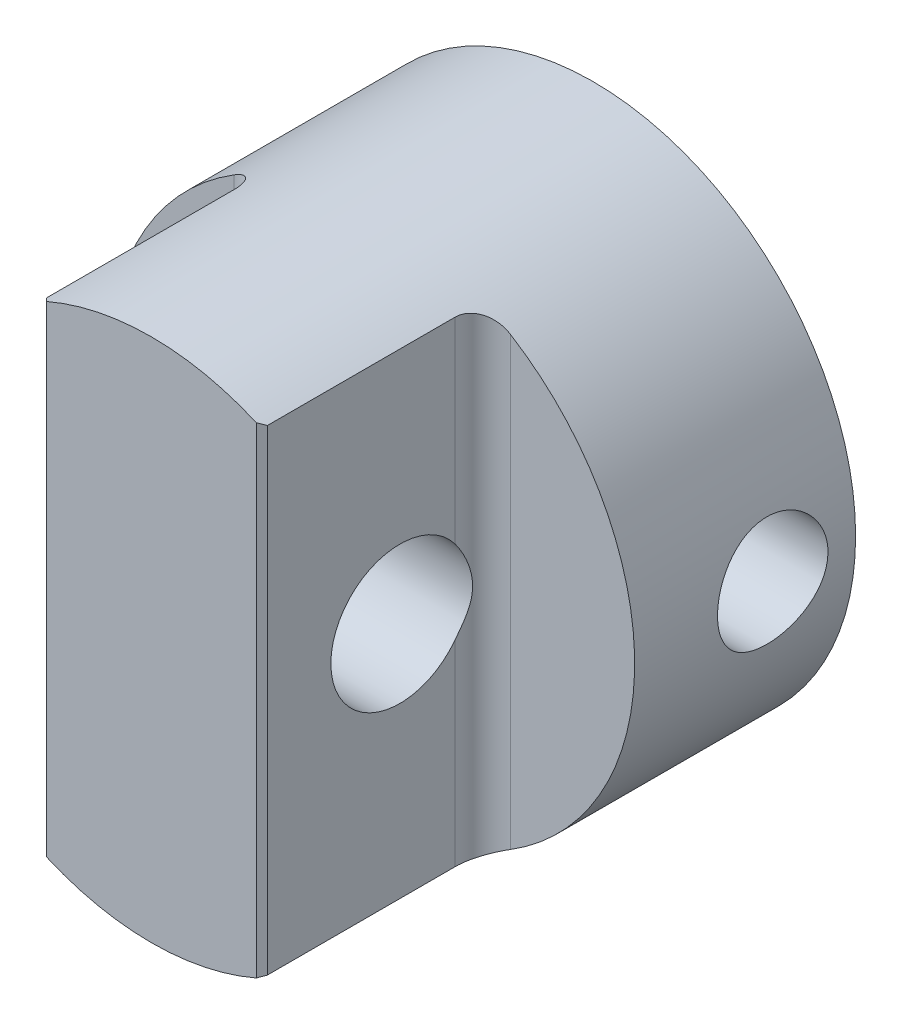
from build123d import *

# Parameters (mm, degrees)
SKETCH_1_R               = 47.5
EXTRUDE_1_DEPTH          = 80
CUT_EXTRUDE_START        = -40
CUT_EXTRUDE_1_DEPTH      = 40
FILLET_1_R               = 5
SKETCH_3_R               = 12.5
CUT_EXTRUDE_2_DEPTH      = 115.945639495
CHAMFER_1_SIZE           = 1
CUT_EXTRUDE_3_DEPTH      = 105.462912246
CUT_EXTRUDE_3_DEPTH_BACK = 105.462912246
SKETCH_4_R               = 10


with BuildPart() as part:
    # Эскиз1 → Бобышка-Вытянуть1 (new body)
    with BuildSketch(Plane.XY):
        Circle(SKETCH_1_R)
    extrude(amount=EXTRUDE_1_DEPTH)

    # Эскиз2 → Вырез-Вытянуть1 (cut)
    with BuildSketch(Plane.XY.offset(80).offset(CUT_EXTRUDE_START)):
        with BuildLine():
            Line((20, -43.084219849), (20, 43.084219849))
            ThreePointArc((20, 43.084219849), (47.5, 0), (20, -43.084219849))
        make_face()
        with BuildLine():
            Line((-20, -43.084219849), (-20, 43.084219849))
            ThreePointArc((-20, 43.084219849), (-47.5, 0), (-20, -43.084219849))
        make_face()
    extrude(amount=CUT_EXTRUDE_1_DEPTH, mode=Mode.SUBTRACT)

    # Скругление1
    fillet_1_edges = [part.edges().sort_by_distance(p)[0] for p in [
        (-20, 0, 40),
        (20, 0, 40),
    ]]
    fillet(fillet_1_edges, radius=FILLET_1_R)

    # Эскиз3 → Вырез-Вытянуть2 (cut, through all)
    with BuildSketch(Plane.ZY.offset(20)):
        with Locations(Location((55, 0, 0), (0, 0, 216.869897646))):
            Circle(SKETCH_3_R)
    extrude(amount=-CUT_EXTRUDE_2_DEPTH, mode=Mode.SUBTRACT)

    # Фаска1
    chamfer_1_edges = [part.edges().sort_by_distance(p)[0] for p in [
        (-20, 0, 80),
        (20, 0, 80),
    ]]
    chamfer(chamfer_1_edges, length=CHAMFER_1_SIZE)

    # Эскиз4 → Вырез-Вытянуть3 (cut, two sides: drawn at the far end of the back side and taken through both)
    with BuildSketch(Plane(origin=(0, 0, 0), x_dir=(0, 0, -1), z_dir=(1, 0, 0)).offset(-CUT_EXTRUDE_3_DEPTH_BACK)):
        with Locations((-15, 0)):
            Circle(SKETCH_4_R)
    extrude(amount=CUT_EXTRUDE_3_DEPTH + CUT_EXTRUDE_3_DEPTH_BACK, mode=Mode.SUBTRACT)


solid = part.part
